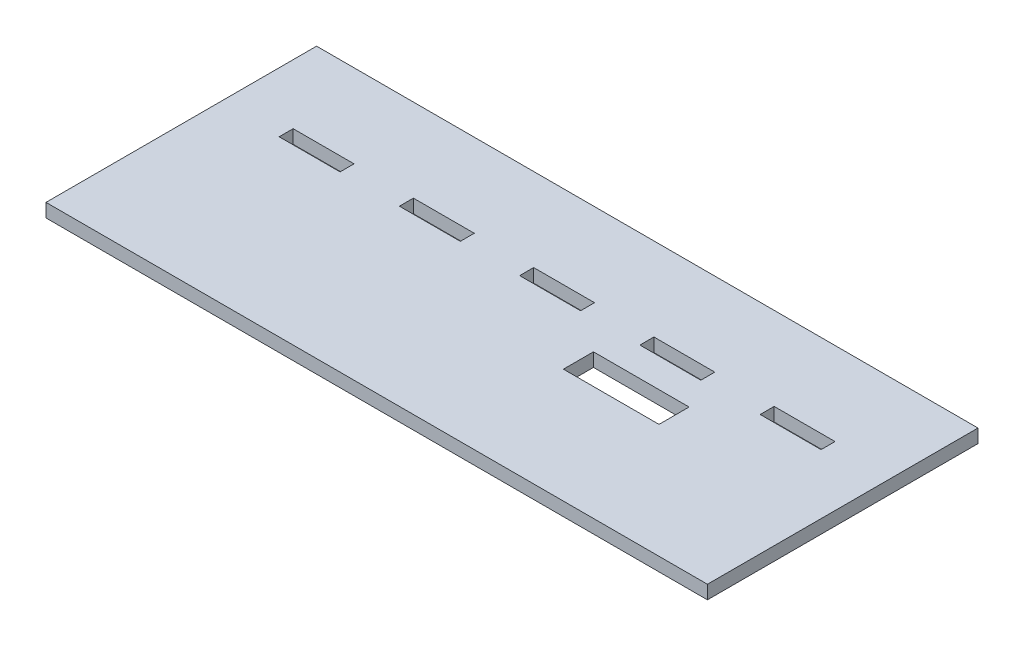
from build123d import *

# Parameters (mm, degrees)
SKETCH2_W            = 220
SKETCH2_H            = 90
BOSS_EXTRUDE1_DEPTH  = 4.5
SKETCH3_W            = 20.25
SKETCH3_H            = 4.65
CUT_EXTRUDE1_DEPTH   = 119.933805119
SKETCH4_W            = 31.802775074
SKETCH4_H            = 10
INPUT_LINK_CUT_DEPTH = 119.933805119


with BuildPart() as part:
    # Sketch2 → Boss-Extrude1 (new body)
    with BuildSketch(Plane(origin=(0, 0, 0), x_dir=(1, 0, 0), z_dir=(0, 1, 0))):
        Rectangle(SKETCH2_W, SKETCH2_H)
    extrude(amount=BOSS_EXTRUDE1_DEPTH)

    # Sketch3 → Cut-Extrude1 (cut, through all)
    with BuildSketch(Plane.XZ):
        with Locations((40, -15)):
            Rectangle(SKETCH3_W, SKETCH3_H)
        with Locations((0, -15)):
            Rectangle(SKETCH3_W, SKETCH3_H)
        with Locations((80, -15)):
            Rectangle(SKETCH3_W, SKETCH3_H)
        with Locations((-80, -15)):
            Rectangle(SKETCH3_W, SKETCH3_H)
        with Locations((-40, -15)):
            Rectangle(SKETCH3_W, SKETCH3_H)
    extrude(amount=-CUT_EXTRUDE1_DEPTH, mode=Mode.SUBTRACT)

    # Sketch4 → Input link cut (cut, through all)
    with BuildSketch(Plane.XZ):
        with Locations((40, 2)):
            Rectangle(SKETCH4_W, SKETCH4_H)
    extrude(amount=-INPUT_LINK_CUT_DEPTH, mode=Mode.SUBTRACT)


solid = part.part
